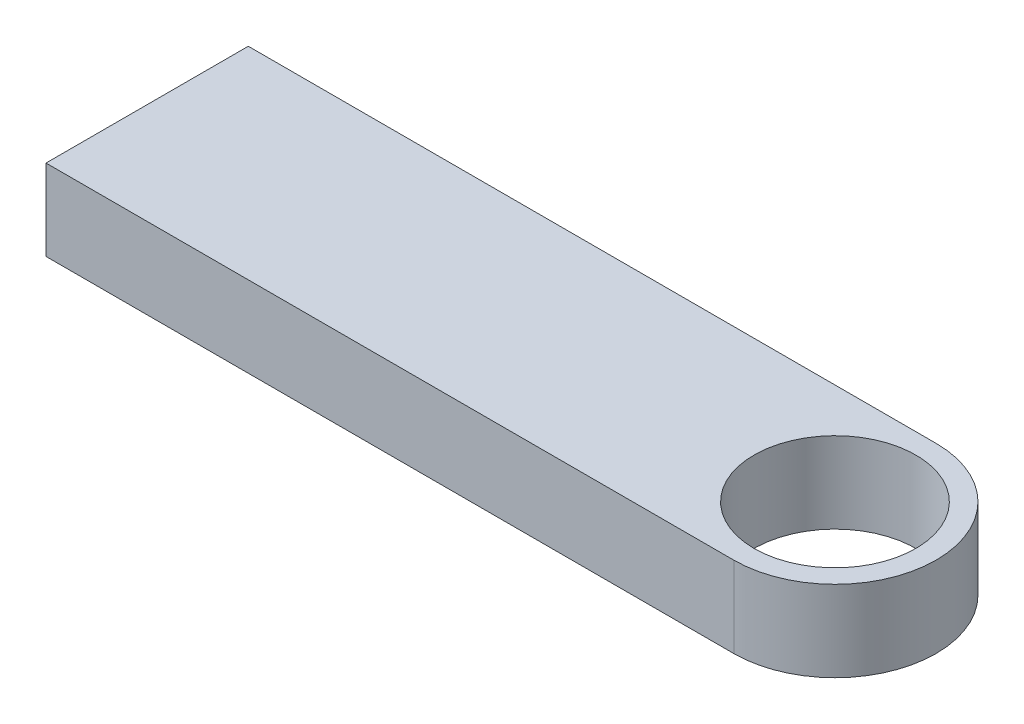
from build123d import *

# Parameters (mm, degrees)
EXTRUDE_1_DEPTH     = 2
SKETCH_2_R          = 2
CUT_EXTRUDE_1_DEPTH = 3


with BuildPart() as part:
    # Эскиз1 → Бобышка-Вытянуть1 (new body)
    with BuildSketch(Plane(origin=(0, 0, 0), x_dir=(1, 0, 0), z_dir=(0, 1, 0))):
        with BuildLine():
            Line((0, 2.5), (-17, 2.5))
            Line((-17, 2.5), (-17, -2.5))
            Line((-17, -2.5), (0, -2.5))
            ThreePointArc((0, -2.5), (2.5, 0), (0, 2.5))
        make_face()
    extrude(amount=EXTRUDE_1_DEPTH)

    # Эскиз2 → Вырез-Вытянуть1 (cut)
    with BuildSketch(Plane(origin=(0, 2, 0), x_dir=(1, 0, 0), z_dir=(0, 1, 0))):
        with Locations(Location((0, 0, 0), (0, 0, 270))):
            Circle(SKETCH_2_R)
    extrude(amount=-CUT_EXTRUDE_1_DEPTH, mode=Mode.SUBTRACT)


solid = part.part
